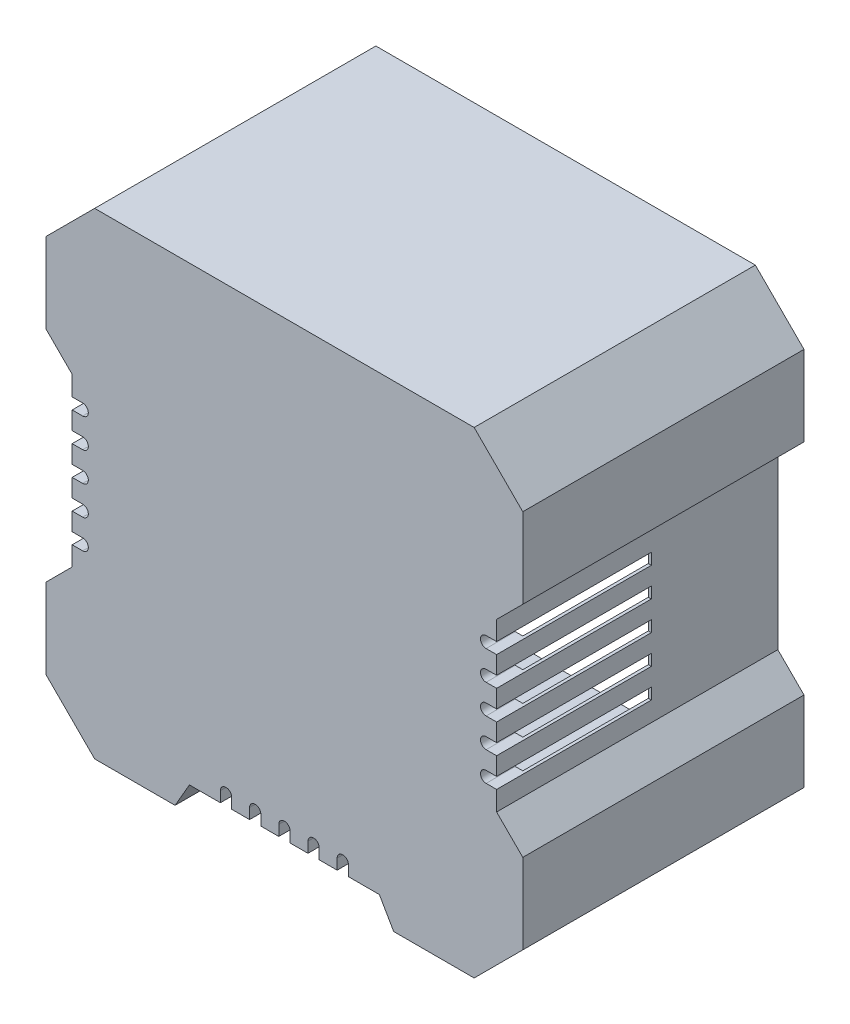
from build123d import *

# Parameters (mm, degrees)
SKETCH1_W           = 49
SKETCH1_H           = 49
BOSS_EXTRUDE1_DEPTH = 28.9
SKETCH2_W           = 43
SKETCH2_H           = 43
CUT_EXTRUDE1_DEPTH  = 25.9
CUT_EXTRUDE2_DEPTH  = 46.11884307
CUT_EXTRUDE3_DEPTH  = 15.9


with BuildPart() as part:
    # Sketch1 → Boss-Extrude1 (new body)
    with BuildSketch(Plane.XY):
        Rectangle(SKETCH1_W, SKETCH1_H)
    extrude(amount=BOSS_EXTRUDE1_DEPTH)

    # Sketch2 → Cut-Extrude1 (cut)
    with BuildSketch(Plane(origin=(0, 0, 0), x_dir=(-1, 0, 0), z_dir=(0, 0, -1))):
        Rectangle(SKETCH2_W, SKETCH2_H)
    extrude(amount=-CUT_EXTRUDE1_DEPTH, mode=Mode.SUBTRACT)

    # Sketch3 → Cut-Extrude2 (cut, through all)
    with BuildSketch(Plane.XY.offset(28.9)):
        Polygon((-21.809403406, 8.570892497), (-24.5, 11.26148909), (-24.5, -11.26148909), (-21.809403406, -8.570892497), align=None)
        Polygon((-19.5, -24.5), (-24.5, -19.5), (-24.5, -24.5), align=None)
        Polygon((-9.757939822, -21.943201951), (-11.234107864, -24.5), (11.234107864, -24.5), (9.757939822, -21.943201951), align=None)
        Polygon((24.5, -24.5), (24.5, -19.5), (19.5, -24.5), align=None)
        Polygon((24.5, -11.26148909), (24.5, 11.26148909), (21.809403406, 8.570892497), (21.809403406, -8.570892497), align=None)
        Polygon((-24.5, 19.5), (-19.5, 24.5), (-24.5, 24.5), align=None)
        Polygon((24.5, 24.5), (19.5, 24.5), (24.5, 19.5), align=None)
    extrude(amount=-CUT_EXTRUDE2_DEPTH, mode=Mode.SUBTRACT)

    # Sketch4 → Cut-Extrude3 (cut)
    with BuildSketch(Plane.XY.offset(28.9)):
        with BuildLine():
            Line((-21.809403406, -6.596640664), (-20.73011061, -6.596640664))
            ThreePointArc((-20.73011061, -6.596640664), (-20.151207618, -6.017737672), (-20.73011061, -5.43883468))
            Line((-20.73011061, -5.43883468), (-21.809403406, -5.43883468))
            ThreePointArc((-21.809403406, -5.43883468), (-22.388306399, -6.017737672), (-21.809403406, -6.596640664))
        make_face()
        with BuildLine():
            Line((-21.809403406, -3.596640664), (-20.73011061, -3.596640664))
            ThreePointArc((-20.73011061, -3.596640664), (-20.151207618, -3.017737672), (-20.73011061, -2.43883468))
            Line((-20.73011061, -2.43883468), (-21.809403406, -2.43883468))
            ThreePointArc((-21.809403406, -2.43883468), (-22.388306399, -3.017737672), (-21.809403406, -3.596640664))
        make_face()
        with BuildLine():
            Line((-21.809403406, -0.596640664), (-20.73011061, -0.596640664))
            ThreePointArc((-20.73011061, -0.596640664), (-20.151207618, -0.017737672), (-20.73011061, 0.56116532))
            Line((-20.73011061, 0.56116532), (-21.809403406, 0.56116532))
            ThreePointArc((-21.809403406, 0.56116532), (-22.388306399, -0.017737672), (-21.809403406, -0.596640664))
        make_face()
        with BuildLine():
            Line((-21.809403406, 2.403359336), (-20.73011061, 2.403359336))
            ThreePointArc((-20.73011061, 2.403359336), (-20.151207618, 2.982262328), (-20.73011061, 3.56116532))
            Line((-20.73011061, 3.56116532), (-21.809403406, 3.56116532))
            ThreePointArc((-21.809403406, 3.56116532), (-22.388306399, 2.982262328), (-21.809403406, 2.403359336))
        make_face()
        with BuildLine():
            Line((-21.809403406, 5.403359336), (-20.73011061, 5.403359336))
            ThreePointArc((-20.73011061, 5.403359336), (-20.151207618, 5.982262328), (-20.73011061, 6.56116532))
            Line((-20.73011061, 6.56116532), (-21.809403406, 6.56116532))
            ThreePointArc((-21.809403406, 6.56116532), (-22.388306399, 5.982262328), (-21.809403406, 5.403359336))
        make_face()
        with BuildLine():
            Line((21.809403406, -5.403359336), (20.73011061, -5.403359336))
            ThreePointArc((20.73011061, -5.403359336), (20.151207618, -5.982262328), (20.73011061, -6.56116532))
            Line((20.73011061, -6.56116532), (21.809403406, -6.56116532))
            ThreePointArc((21.809403406, -6.56116532), (22.388306399, -5.982262328), (21.809403406, -5.403359336))
        make_face()
        with BuildLine():
            Line((21.809403406, -2.403359336), (20.73011061, -2.403359336))
            ThreePointArc((20.73011061, -2.403359336), (20.151207618, -2.982262328), (20.73011061, -3.56116532))
            Line((20.73011061, -3.56116532), (21.809403406, -3.56116532))
            ThreePointArc((21.809403406, -3.56116532), (22.388306399, -2.982262328), (21.809403406, -2.403359336))
        make_face()
        with BuildLine():
            Line((21.809403406, 0.596640664), (20.73011061, 0.596640664))
            ThreePointArc((20.73011061, 0.596640664), (20.151207618, 0.017737672), (20.73011061, -0.56116532))
            Line((20.73011061, -0.56116532), (21.809403406, -0.56116532))
            ThreePointArc((21.809403406, -0.56116532), (22.388306399, 0.017737672), (21.809403406, 0.596640664))
        make_face()
        with BuildLine():
            Line((21.809403406, 3.596640664), (20.73011061, 3.596640664))
            ThreePointArc((20.73011061, 3.596640664), (20.151207618, 3.017737672), (20.73011061, 2.43883468))
            Line((20.73011061, 2.43883468), (21.809403406, 2.43883468))
            ThreePointArc((21.809403406, 2.43883468), (22.388306399, 3.017737672), (21.809403406, 3.596640664))
        make_face()
        with BuildLine():
            Line((21.809403406, 6.596640664), (20.73011061, 6.596640664))
            ThreePointArc((20.73011061, 6.596640664), (20.151207618, 6.017737672), (20.73011061, 5.43883468))
            Line((20.73011061, 5.43883468), (21.809403406, 5.43883468))
            ThreePointArc((21.809403406, 5.43883468), (22.388306399, 6.017737672), (21.809403406, 6.596640664))
        make_face()
        with BuildLine():
            Line((5.421097008, -20.863909155), (5.421097008, -21.943201951))
            ThreePointArc((5.421097008, -21.943201951), (6, -22.522104943), (6.578902992, -21.943201951))
            Line((6.578902992, -21.943201951), (6.578902992, -20.863909155))
            ThreePointArc((6.578902992, -20.863909155), (6, -20.285006162), (5.421097008, -20.863909155))
        make_face()
        with BuildLine():
            Line((2.421097008, -20.863909155), (2.421097008, -21.943201951))
            ThreePointArc((2.421097008, -21.943201951), (3, -22.522104943), (3.578902992, -21.943201951))
            Line((3.578902992, -21.943201951), (3.578902992, -20.863909155))
            ThreePointArc((3.578902992, -20.863909155), (3, -20.285006162), (2.421097008, -20.863909155))
        make_face()
        with BuildLine():
            Line((-0.578902992, -20.863909155), (-0.578902992, -21.943201951))
            ThreePointArc((-0.578902992, -21.943201951), (0, -22.522104943), (0.578902992, -21.943201951))
            Line((0.578902992, -21.943201951), (0.578902992, -20.863909155))
            ThreePointArc((0.578902992, -20.863909155), (0, -20.285006162), (-0.578902992, -20.863909155))
        make_face()
        with BuildLine():
            Line((-3.578902992, -20.863909155), (-3.578902992, -21.943201951))
            ThreePointArc((-3.578902992, -21.943201951), (-3, -22.522104943), (-2.421097008, -21.943201951))
            Line((-2.421097008, -21.943201951), (-2.421097008, -20.863909155))
            ThreePointArc((-2.421097008, -20.863909155), (-3, -20.285006162), (-3.578902992, -20.863909155))
        make_face()
        with BuildLine():
            Line((-6.578902992, -20.863909155), (-6.578902992, -21.943201951))
            ThreePointArc((-6.578902992, -21.943201951), (-6, -22.522104943), (-5.421097008, -21.943201951))
            Line((-5.421097008, -21.943201951), (-5.421097008, -20.863909155))
            ThreePointArc((-5.421097008, -20.863909155), (-6, -20.285006162), (-6.578902992, -20.863909155))
        make_face()
    extrude(amount=-CUT_EXTRUDE3_DEPTH, mode=Mode.SUBTRACT)


solid = part.part
